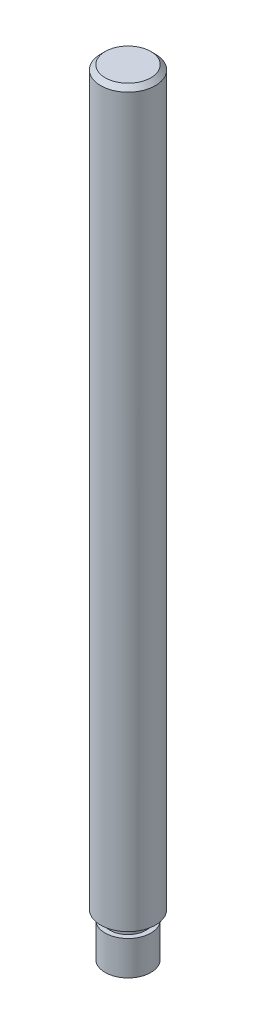
from build123d import *

# Parameters (mm, degrees)
CHAMFER1_SIZE = 1


with BuildPart() as part:
    # Sketch1 → Revolve1 (revolve)
    with BuildSketch(Plane.XY, mode=Mode.PRIVATE) as revolve1_sk:
        Polygon((0, 0), (5, 0), (5, 7.5), (3.95, 7.5), (3.95, 9.5), (6, 9.5), (6, 170), (0, 170), align=None)
    revolve(revolve1_sk.sketch.rotate(Axis((0, 0, 0), (0, 1, 0)), 90), axis=Axis((0, 0, 0), (0, 1, 0)))

    # Chamfer1
    chamfer1_edges = [part.edges().sort_by_distance(p)[0] for p in [
        (0, 170, 6),
    ]]
    chamfer(chamfer1_edges, length=CHAMFER1_SIZE)


solid = part.part
